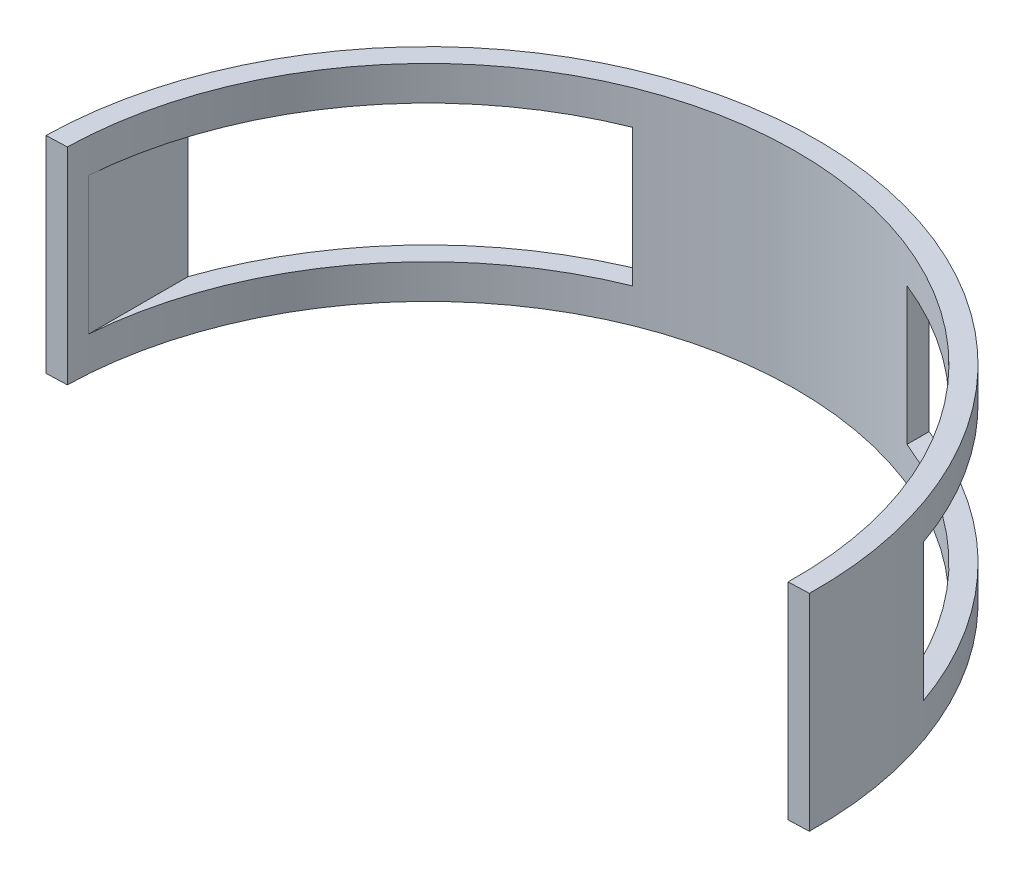
from build123d import *

# Parameters (mm, degrees)
BOSS_EXTRUDE1_DEPTH = 15
SKETCH4_W           = 33.524511878
SKETCH4_H           = 20
CUT_EXTRUDE2_DEPTH  = 200


with BuildPart() as part:
    # Sketch1 → Boss-Extrude1 (new, symmetric)
    with BuildSketch(Plane(origin=(0, 0, 0), x_dir=(1, 0, 0), z_dir=(0, 1, 0))):
        with BuildLine():
            Line((-56.6451424, 1.085173475), (-53.646875163, 1.186754079))
            ThreePointArc((-53.646875163, 1.186754079), (1.186754079, 53.646875163), (53.646875163, -1.186754079))
            Line((53.646875163, -1.186754079), (56.645146911, -1.084937955))
            ThreePointArc((56.645146911, -1.084937955), (1.085055715, 56.645144656), (-56.6451424, 1.085173475))
        make_face()
    extrude(amount=BOSS_EXTRUDE1_DEPTH, both=True)

    # Sketch4 → Cut-Extrude2 (cut)
    with BuildSketch(Plane.XY):
        with Locations((-36.737744061, 0)):
            Rectangle(SKETCH4_W, SKETCH4_H)
        with Locations((36.737744061, 0)):
            Rectangle(SKETCH4_W, SKETCH4_H)
    extrude(amount=-CUT_EXTRUDE2_DEPTH, mode=Mode.SUBTRACT)


solid = part.part
